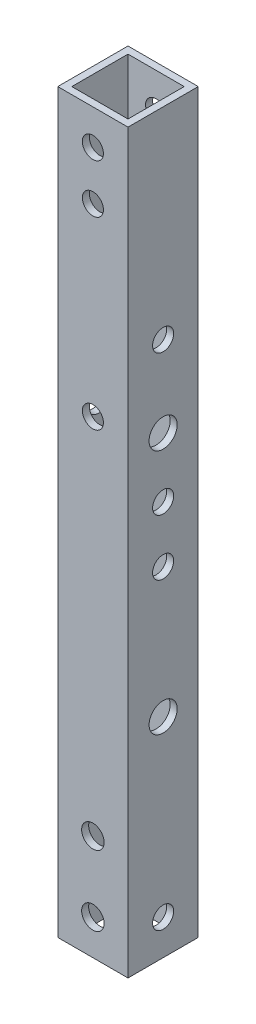
from build123d import *

# Parameters (mm, degrees)
SKETCH_1_W          = 10
SKETCH_1_H          = 10
SKETCH_1_W_2        = 8
SKETCH_1_H_2        = 8
EXTRUDE_1_DEPTH     = 104.9
SKETCH_2_R          = 1.6
SKETCH_2_R_2        = 1.5
CUT_EXTRUDE_1_DEPTH = 106.494123059
SKETCH_3_R          = 1.5
SKETCH_3_R_2        = 2
CUT_EXTRUDE_2_DEPTH = 106.494123059


with BuildPart() as part:
    # ｽｹｯﾁ1 → 押し出し-薄板1 (new body)
    with BuildSketch(Plane(origin=(0, 0, 0), x_dir=(1, 0, 0), z_dir=(0, 1, 0))):
        Rectangle(SKETCH_1_W, SKETCH_1_H)
        Rectangle(SKETCH_1_W_2, SKETCH_1_H_2, mode=Mode.SUBTRACT)
    extrude(amount=EXTRUDE_1_DEPTH)

    # ｽｹｯﾁ2 → ｶｯﾄ - 押し出し1 (cut, through all)
    with BuildSketch(Plane.XY.offset(5)):
        with Locations((0, 5)):
            Circle(SKETCH_2_R)
        with Locations((0, 15)):
            Circle(SKETCH_2_R)
        with Locations((0, 92.95)):
            Circle(SKETCH_2_R_2)
        with Locations((0, 66.7)):
            Circle(SKETCH_2_R_2)
        with Locations((0, 99.9)):
            Circle(SKETCH_2_R_2)
    extrude(amount=-CUT_EXTRUDE_1_DEPTH, mode=Mode.SUBTRACT)

    # ｽｹｯﾁ3 → ｶｯﾄ - 押し出し2 (cut, through all)
    with BuildSketch(Plane(origin=(5, 0, 0), x_dir=(0, 0, -1), z_dir=(1, 0, 0))):
        with Locations((0, 76.2)):
            Circle(SKETCH_3_R)
        with Locations((0, 5)):
            Circle(SKETCH_3_R)
        with Locations((0, 64.7)):
            Circle(SKETCH_3_R_2)
        with Locations((0, 29.7)):
            Circle(SKETCH_3_R_2)
        with Locations((0, 48.2)):
            Circle(SKETCH_3_R)
        with Locations((0, 56.2)):
            Circle(SKETCH_3_R)
    extrude(amount=-CUT_EXTRUDE_2_DEPTH, mode=Mode.SUBTRACT)


solid = part.part
